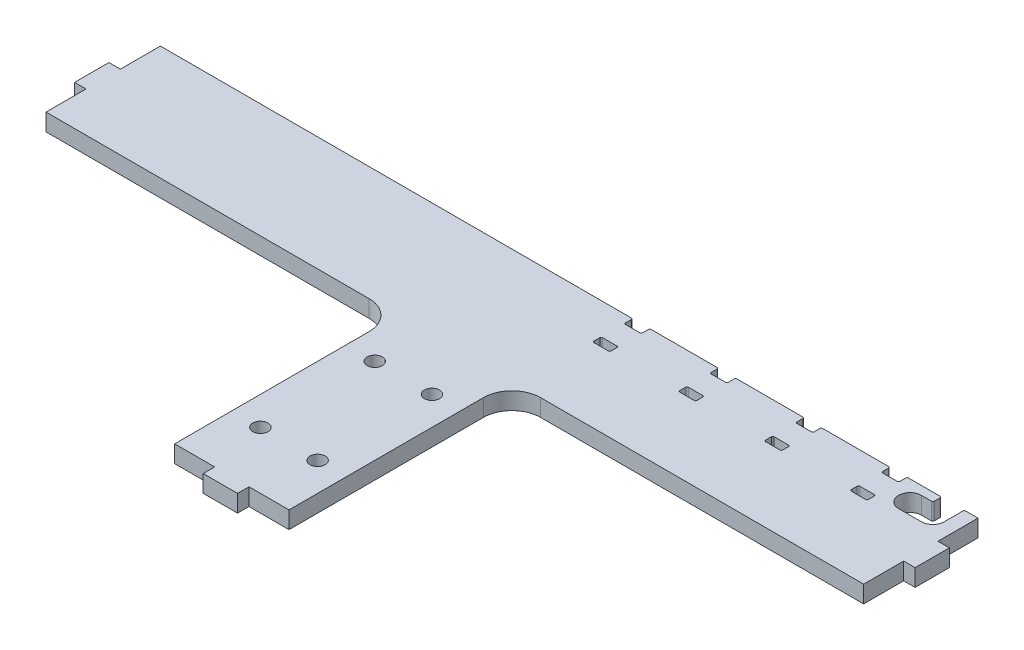
from build123d import *

# Parameters (mm, degrees)
BOSS_EXTRUDE1_DEPTH = 3
FILLET1_R           = 5
CUT_EXTRUDE1_REACH  = 83.25
SKETCH2_R           = 1.325
CUT_EXTRUDE3_REACH  = 83.25
FILLET2_R           = 0.25


with BuildPart() as part:
    # Sketch1 → Boss-Extrude1 (new body)
    with BuildSketch(Plane(origin=(0, 0, 0), x_dir=(1, 0, 0), z_dir=(0, 1, 0))):
        Polygon((-71.5, 34.5), (-71.5, 27.5), (-73.5, 27.5), (-73.5, 21.5), (-71.5, 21.5), (-71.5, 14.5), (-10, 14.5), (-10, -24.5), (-3, -24.5), (-3, -26.5), (3, -26.5), (3, -24.5), (10, -24.5), (10, 14.5), (71.5, 14.5), (71.5, 21.5), (73.5, 21.5), (73.5, 27.5), (71.5, 27.5), (71.5, 34.5), align=None)
    extrude(amount=BOSS_EXTRUDE1_DEPTH)

    # Fillet1
    fillet1_edges = [part.edges().sort_by_distance(p)[0] for p in [
        (-10, 1.5, -14.5),
        (10, 1.5, -14.5),
    ]]
    fillet(fillet1_edges, radius=FILLET1_R)

    # Sketch2 → Cut-Extrude1 (cut, up to next)
    with BuildSketch(Plane(origin=(0, 3, 0), x_dir=(1, 0, 0), z_dir=(0, 1, 0)), mode=Mode.PRIVATE) as cut_extrude1_sk1:
        with Locations((-5, -14.5)):
            Circle(SKETCH2_R)
    cut_extrude1_tool1 = extrude(cut_extrude1_sk1.sketch, amount=-CUT_EXTRUDE1_REACH, mode=Mode.PRIVATE) & part.part
    # Sketch2 → Cut-Extrude1 (cut, up to next)
    with BuildSketch(Plane(origin=(0, 3, 0), x_dir=(1, 0, 0), z_dir=(0, 1, 0)), mode=Mode.PRIVATE) as cut_extrude1_sk2:
        with Locations((-5, 5.5)):
            Circle(SKETCH2_R)
    cut_extrude1_tool2 = extrude(cut_extrude1_sk2.sketch, amount=-CUT_EXTRUDE1_REACH, mode=Mode.PRIVATE) & part.part
    # Sketch2 → Cut-Extrude1 (cut, up to next)
    with BuildSketch(Plane(origin=(0, 3, 0), x_dir=(1, 0, 0), z_dir=(0, 1, 0)), mode=Mode.PRIVATE) as cut_extrude1_sk3:
        with Locations((5, 5.5)):
            Circle(SKETCH2_R)
    cut_extrude1_tool3 = extrude(cut_extrude1_sk3.sketch, amount=-CUT_EXTRUDE1_REACH, mode=Mode.PRIVATE) & part.part
    # Sketch2 → Cut-Extrude1 (cut, up to next)
    with BuildSketch(Plane(origin=(0, 3, 0), x_dir=(1, 0, 0), z_dir=(0, 1, 0)), mode=Mode.PRIVATE) as cut_extrude1_sk4:
        with Locations((5, -14.5)):
            Circle(SKETCH2_R)
    cut_extrude1_tool4 = extrude(cut_extrude1_sk4.sketch, amount=-CUT_EXTRUDE1_REACH, mode=Mode.PRIVATE) & part.part
    add(cut_extrude1_tool1.solids().sort_by_distance((-5, 3, 14.5))[0], mode=Mode.SUBTRACT)
    add(cut_extrude1_tool2.solids().sort_by_distance((-5, 3, -5.5))[0], mode=Mode.SUBTRACT)
    add(cut_extrude1_tool3.solids().sort_by_distance((5, 3, -5.5))[0], mode=Mode.SUBTRACT)
    add(cut_extrude1_tool4.solids().sort_by_distance((5, 3, 14.5))[0], mode=Mode.SUBTRACT)

    # Sketch3 → Cut-Extrude3 (cut, up to next)
    with BuildSketch(Plane(origin=(0, 3, 0), x_dir=(1, 0, 0), z_dir=(0, 1, 0)), mode=Mode.PRIVATE) as cut_extrude3_sk1:
        with BuildLine():
            Line((59.1, 34.5), (56.1, 34.5))
            Line((56.1, 34.5), (56.1, 33.25))
            ThreePointArc((56.1, 33.25), (56.173223305, 33.073223305), (56.35, 33))
            Line((56.35, 33), (58.85, 33))
            ThreePointArc((58.85, 33), (59.026776695, 33.073223305), (59.1, 33.25))
            Line((59.1, 33.25), (59.1, 34.5))
        make_face()
    cut_extrude3_tool1 = extrude(cut_extrude3_sk1.sketch, amount=-CUT_EXTRUDE3_REACH, mode=Mode.PRIVATE) & part.part
    # Sketch3 → Cut-Extrude3 (cut, up to next)
    with BuildSketch(Plane(origin=(0, 3, 0), x_dir=(1, 0, 0), z_dir=(0, 1, 0)), mode=Mode.PRIVATE) as cut_extrude3_sk2:
        with BuildLine():
            Line((65.1, 33), (63.1, 33))
            ThreePointArc((63.1, 33), (61.1, 31), (63.1, 29))
            Line((63.1, 29), (67.1, 29))
            ThreePointArc((67.1, 29), (68.514213562, 29.585786438), (69.1, 31))
            Line((69.1, 31), (69.1, 34.5))
            Line((69.1, 34.5), (65.1, 34.5))
            Line((65.1, 34.5), (65.1, 33))
        make_face()
    cut_extrude3_tool2 = extrude(cut_extrude3_sk2.sketch, amount=-CUT_EXTRUDE3_REACH, mode=Mode.PRIVATE) & part.part
    # Sketch3 → Cut-Extrude3 (cut, up to next)
    with BuildSketch(Plane(origin=(0, 3, 0), x_dir=(1, 0, 0), z_dir=(0, 1, 0)), mode=Mode.PRIVATE) as cut_extrude3_sk3:
        with BuildLine():
            Line((56.1, 28.75), (56.1, 27.75))
            ThreePointArc((56.1, 27.75), (56.173223305, 27.573223305), (56.35, 27.5))
            Line((56.35, 27.5), (58.85, 27.5))
            ThreePointArc((58.85, 27.5), (59.026776695, 27.573223305), (59.1, 27.75))
            Line((59.1, 27.75), (59.1, 28.75))
            ThreePointArc((59.1, 28.75), (59.026776695, 28.926776695), (58.85, 29))
            Line((58.85, 29), (56.35, 29))
            ThreePointArc((56.35, 29), (56.173223305, 28.926776695), (56.1, 28.75))
        make_face()
    cut_extrude3_tool3 = extrude(cut_extrude3_sk3.sketch, amount=-CUT_EXTRUDE3_REACH, mode=Mode.PRIVATE) & part.part
    # Sketch3 → Cut-Extrude3 (cut, up to next)
    with BuildSketch(Plane(origin=(0, 3, 0), x_dir=(1, 0, 0), z_dir=(0, 1, 0)), mode=Mode.PRIVATE) as cut_extrude3_sk4:
        with BuildLine():
            ThreePointArc((41.1, 27.75), (41.173223305, 27.573223305), (41.35, 27.5))
            Line((41.35, 27.5), (43.85, 27.5))
            ThreePointArc((43.85, 27.5), (44.026776695, 27.573223305), (44.1, 27.75))
            Line((44.1, 27.75), (44.1, 28.75))
            ThreePointArc((44.1, 28.75), (44.026776695, 28.926776695), (43.85, 29))
            Line((43.85, 29), (41.35, 29))
            ThreePointArc((41.35, 29), (41.173223305, 28.926776695), (41.1, 28.75))
            Line((41.1, 28.75), (41.1, 27.75))
        make_face()
    cut_extrude3_tool4 = extrude(cut_extrude3_sk4.sketch, amount=-CUT_EXTRUDE3_REACH, mode=Mode.PRIVATE) & part.part
    # Sketch3 → Cut-Extrude3 (cut, up to next)
    with BuildSketch(Plane(origin=(0, 3, 0), x_dir=(1, 0, 0), z_dir=(0, 1, 0)), mode=Mode.PRIVATE) as cut_extrude3_sk5:
        with BuildLine():
            ThreePointArc((41.1, 33.25), (41.173223305, 33.073223305), (41.35, 33))
            Line((41.35, 33), (43.85, 33))
            ThreePointArc((43.85, 33), (44.026776695, 33.073223305), (44.1, 33.25))
            Line((44.1, 33.25), (44.1, 34.5))
            Line((44.1, 34.5), (41.1, 34.5))
            Line((41.1, 34.5), (41.1, 33.25))
        make_face()
    cut_extrude3_tool5 = extrude(cut_extrude3_sk5.sketch, amount=-CUT_EXTRUDE3_REACH, mode=Mode.PRIVATE) & part.part
    # Sketch3 → Cut-Extrude3 (cut, up to next)
    with BuildSketch(Plane(origin=(0, 3, 0), x_dir=(1, 0, 0), z_dir=(0, 1, 0)), mode=Mode.PRIVATE) as cut_extrude3_sk6:
        with BuildLine():
            ThreePointArc((26.1, 27.75), (26.173223305, 27.573223305), (26.35, 27.5))
            Line((26.35, 27.5), (28.85, 27.5))
            ThreePointArc((28.85, 27.5), (29.026776695, 27.573223305), (29.1, 27.75))
            Line((29.1, 27.75), (29.1, 28.75))
            ThreePointArc((29.1, 28.75), (29.026776695, 28.926776695), (28.85, 29))
            Line((28.85, 29), (26.35, 29))
            ThreePointArc((26.35, 29), (26.173223305, 28.926776695), (26.1, 28.75))
            Line((26.1, 28.75), (26.1, 27.75))
        make_face()
    cut_extrude3_tool6 = extrude(cut_extrude3_sk6.sketch, amount=-CUT_EXTRUDE3_REACH, mode=Mode.PRIVATE) & part.part
    # Sketch3 → Cut-Extrude3 (cut, up to next)
    with BuildSketch(Plane(origin=(0, 3, 0), x_dir=(1, 0, 0), z_dir=(0, 1, 0)), mode=Mode.PRIVATE) as cut_extrude3_sk7:
        with BuildLine():
            ThreePointArc((26.1, 33.25), (26.173223305, 33.073223305), (26.35, 33))
            Line((26.35, 33), (28.85, 33))
            ThreePointArc((28.85, 33), (29.026776695, 33.073223305), (29.1, 33.25))
            Line((29.1, 33.25), (29.1, 34.5))
            Line((29.1, 34.5), (26.1, 34.5))
            Line((26.1, 34.5), (26.1, 33.25))
        make_face()
    cut_extrude3_tool7 = extrude(cut_extrude3_sk7.sketch, amount=-CUT_EXTRUDE3_REACH, mode=Mode.PRIVATE) & part.part
    # Sketch3 → Cut-Extrude3 (cut, up to next)
    with BuildSketch(Plane(origin=(0, 3, 0), x_dir=(1, 0, 0), z_dir=(0, 1, 0)), mode=Mode.PRIVATE) as cut_extrude3_sk8:
        with BuildLine():
            ThreePointArc((11.1, 27.75), (11.173223305, 27.573223305), (11.35, 27.5))
            Line((11.35, 27.5), (13.85, 27.5))
            ThreePointArc((13.85, 27.5), (14.026776695, 27.573223305), (14.1, 27.75))
            Line((14.1, 27.75), (14.1, 28.75))
            ThreePointArc((14.1, 28.75), (14.026776695, 28.926776695), (13.85, 29))
            Line((13.85, 29), (11.35, 29))
            ThreePointArc((11.35, 29), (11.173223305, 28.926776695), (11.1, 28.75))
            Line((11.1, 28.75), (11.1, 27.75))
        make_face()
    cut_extrude3_tool8 = extrude(cut_extrude3_sk8.sketch, amount=-CUT_EXTRUDE3_REACH, mode=Mode.PRIVATE) & part.part
    # Sketch3 → Cut-Extrude3 (cut, up to next)
    with BuildSketch(Plane(origin=(0, 3, 0), x_dir=(1, 0, 0), z_dir=(0, 1, 0)), mode=Mode.PRIVATE) as cut_extrude3_sk9:
        with BuildLine():
            ThreePointArc((11.1, 33.25), (11.173223305, 33.073223305), (11.35, 33))
            Line((11.35, 33), (13.85, 33))
            ThreePointArc((13.85, 33), (14.026776695, 33.073223305), (14.1, 33.25))
            Line((14.1, 33.25), (14.1, 34.5))
            Line((14.1, 34.5), (11.1, 34.5))
            Line((11.1, 34.5), (11.1, 33.25))
        make_face()
    cut_extrude3_tool9 = extrude(cut_extrude3_sk9.sketch, amount=-CUT_EXTRUDE3_REACH, mode=Mode.PRIVATE) & part.part
    add(cut_extrude3_tool1.solids().sort_by_distance((57.6, 3, -33.754163))[0], mode=Mode.SUBTRACT)
    add(cut_extrude3_tool2.solids().sort_by_distance((65.524848, 3, -31.503414))[0], mode=Mode.SUBTRACT)
    add(cut_extrude3_tool3.solids().sort_by_distance((57.6, 3, -28.25))[0], mode=Mode.SUBTRACT)
    add(cut_extrude3_tool4.solids().sort_by_distance((42.6, 3, -28.25))[0], mode=Mode.SUBTRACT)
    add(cut_extrude3_tool5.solids().sort_by_distance((42.6, 3, -33.754163))[0], mode=Mode.SUBTRACT)
    add(cut_extrude3_tool6.solids().sort_by_distance((27.6, 3, -28.25))[0], mode=Mode.SUBTRACT)
    add(cut_extrude3_tool7.solids().sort_by_distance((27.6, 3, -33.754163))[0], mode=Mode.SUBTRACT)
    add(cut_extrude3_tool8.solids().sort_by_distance((12.6, 3, -28.25))[0], mode=Mode.SUBTRACT)
    add(cut_extrude3_tool9.solids().sort_by_distance((12.6, 3, -33.754163))[0], mode=Mode.SUBTRACT)

    # Fillet2
    fillet2_edges = [part.edges().sort_by_distance(p)[0] for p in [
        (26.1, 1.5, -34.5),
        (29.1, 1.5, -34.5),
        (41.1, 1.5, -34.5),
        (44.1, 1.5, -34.5),
        (56.1, 1.5, -34.5),
        (59.1, 1.5, -34.5),
        (69.1, 1.5, -34.5),
        (65.1, 1.5, -34.5),
        (65.1, 1.5, -33),
        (14.1, 1.5, -34.5),
        (11.1, 1.5, -34.5),
    ]]
    fillet(fillet2_edges, radius=FILLET2_R)


solid = part.part
